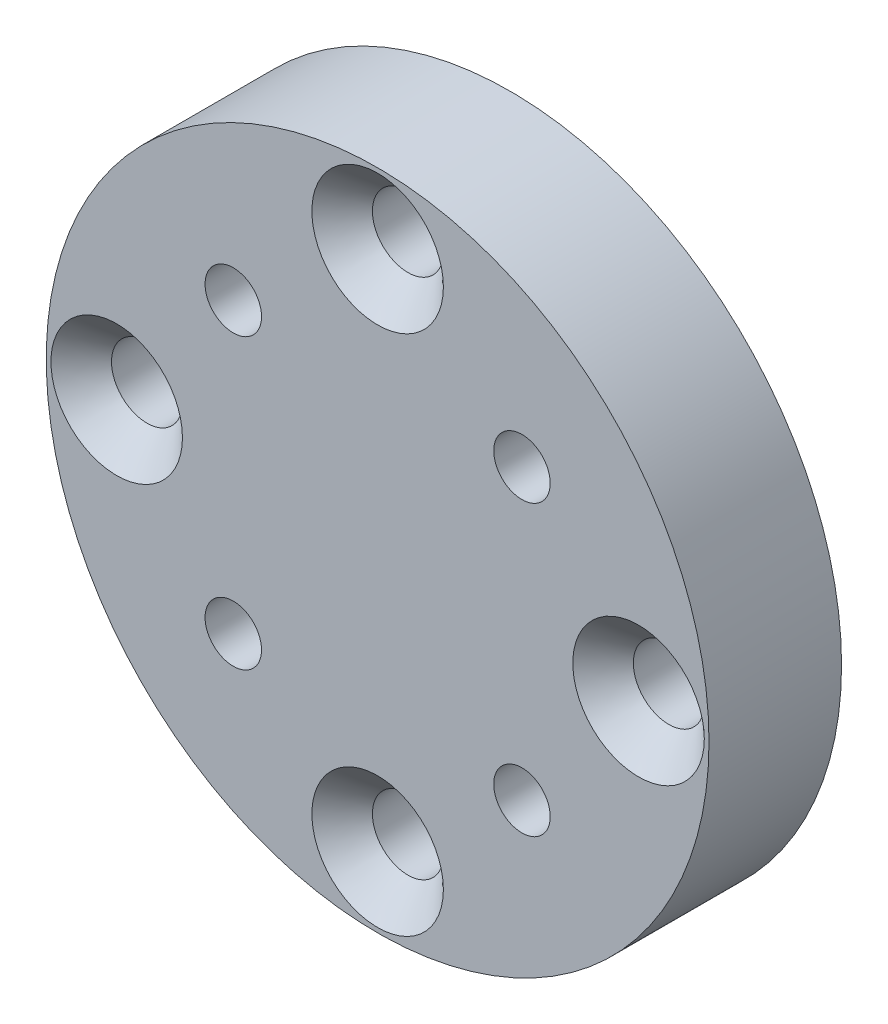
from build123d import *

# Parameters (mm, degrees)
SKETCH1_R                                       = 15.875
BOSS_EXTRUDE1_DEPTH                             = 6.35
CSK_FOR_M3_FLAT_HEAD_MACHINE_SCREW1_D           = 3.4
CSK_FOR_M3_FLAT_HEAD_MACHINE_SCREW1_CSINK_D     = 6.3
CSK_FOR_M3_FLAT_HEAD_MACHINE_SCREW1_CSINK_ANGLE = 90
F_6_32_TAPPED_HOLE1_D                           = 2.7051


with BuildPart() as part:
    # Sketch1 → Boss-Extrude1 (new body)
    with BuildSketch(Plane.XY):
        Circle(SKETCH1_R)
    extrude(amount=BOSS_EXTRUDE1_DEPTH)

    # CSK for M3 Flat Head Machine Screw1 (through all)
    with Locations(Plane.XY.offset(6.35)):
        with Locations((0, 12.5), (0, -12.5), (12.5, 0), (-12.5, 0)):
            CounterSinkHole(CSK_FOR_M3_FLAT_HEAD_MACHINE_SCREW1_D / 2, CSK_FOR_M3_FLAT_HEAD_MACHINE_SCREW1_CSINK_D / 2, counter_sink_angle=CSK_FOR_M3_FLAT_HEAD_MACHINE_SCREW1_CSINK_ANGLE)

    # #6-32 Tapped Hole1 (through all)
    with Locations(Plane.XY.offset(6.35)):
        with Locations((6.914797213, 6.914797213), (6.914797213, -6.914797213), (-6.914797213, -6.914797213), (-6.914797213, 6.914797213)):
            Hole(F_6_32_TAPPED_HOLE1_D / 2)


solid = part.part
